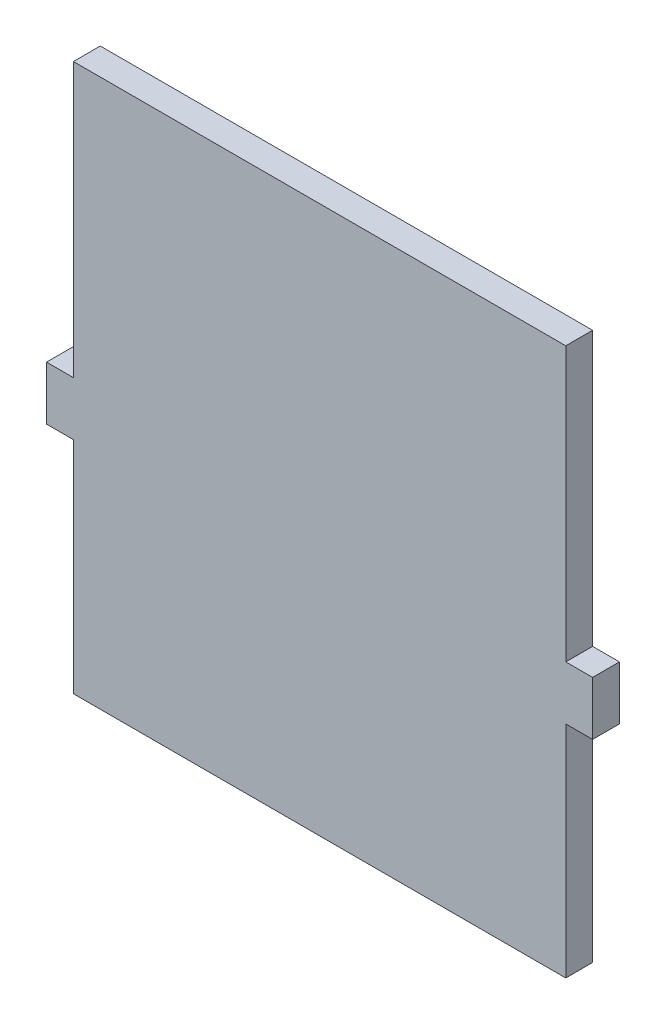
from build123d import *

# Parameters (mm, degrees)
P_IDAT_VYSUNUT_M1_DEPTH = 3


with BuildPart() as part:
    # Skica1 → Přidat vysunutím1 (new body)
    with BuildSketch(Plane.XY):
        Polygon((55, -36.58), (55, -61.16), (0, -61.16), (0, -36.58), (-3, -36.58), (-3, -30.58), (0, -30.58), (0, 0), (55, 0), (55, -30.58), (58, -30.58), (58, -36.58), align=None)
    extrude(amount=P_IDAT_VYSUNUT_M1_DEPTH)


solid = part.part
